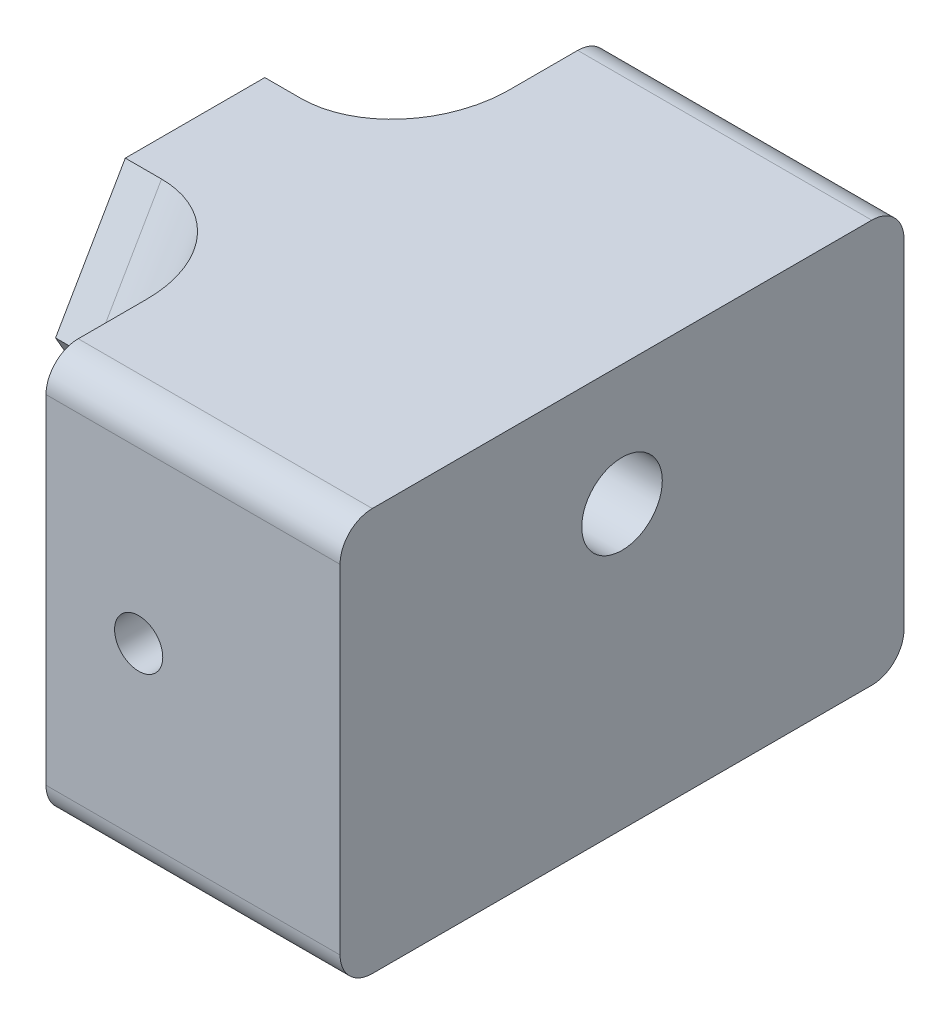
from build123d import *

# Parameters (mm, degrees)
BOSS_EXTRUDE1_DEPTH      = 25.4
BOSS_EXTRUDE1_DEPTH_BACK = 8.255
SKETCH1_W                = 44.45
SKETCH1_H                = 31.75
CUT_EXTRUDE1_DEPTH       = 7.9375
SKETCH3_R                = 3.175
CUT_EXTRUDE2_DEPTH       = 65.160143586
SKETCH4_R                = 1.89865
CUT_EXTRUDE4_DEPTH       = 4.7625
FILLET1_R                = 2.54
CUT_EXTRUDE5_DEPTH       = 10.4775
FILLET2_R                = 7.62


with BuildPart() as part:
    # Sketch1 → Boss-Extrude1 (new, two sides: drawn at the far end of the back side and taken through both)
    with BuildSketch(Plane(origin=(0, 0, 0), x_dir=(0, 0, -1), z_dir=(1, 0, 0)).offset(-BOSS_EXTRUDE1_DEPTH_BACK)):
        with Locations((22.225, -15.875)):
            Rectangle(SKETCH1_W, SKETCH1_H)
    extrude(amount=BOSS_EXTRUDE1_DEPTH + BOSS_EXTRUDE1_DEPTH_BACK)

    # Sketch2 → Cut-Extrude1 (cut)
    with BuildSketch(Plane.ZY.offset(8.255)):
        Polygon((-18.558825791, -15.875), (-14.892651581, -9.525), (-18.558825791, -3.175), (-25.891174209, -3.175), (-29.557348419, -9.525), (-25.891174209, -15.875), align=None)
    extrude(amount=-CUT_EXTRUDE1_DEPTH, mode=Mode.SUBTRACT)

    # Sketch3 → Cut-Extrude2 (cut, through all)
    with BuildSketch(Plane(origin=(25.4, 0, 0), x_dir=(0, 0, -1), z_dir=(1, 0, 0))):
        with Locations((22.225, -9.525)):
            Circle(SKETCH3_R)
    extrude(amount=-CUT_EXTRUDE2_DEPTH, mode=Mode.SUBTRACT)

    # Sketch4 → Cut-Extrude4 (cut)
    with BuildSketch(Plane.XY):
        with Locations((9.525, -15.875)):
            Circle(SKETCH4_R)
    cut_extrude4 = extrude(amount=-CUT_EXTRUDE4_DEPTH, mode=Mode.SUBTRACT)

    # Mirror3: Cut-Extrude4 across plane
    add(cut_extrude4.mirror(Plane.XY.offset(-22.225)), mode=Mode.SUBTRACT)

    # Fillet1
    fillet1_edges = [part.edges().sort_by_distance(p)[0] for p in [
        (8.5725, 0, 0),
        (8.5725, 0, -44.45),
        (8.5725, -31.75, -44.45),
        (8.5725, -31.75, 0),
    ]]
    fillet(fillet1_edges, radius=FILLET1_R)

    # Sketch5 → Cut-Extrude5 (cut)
    with BuildSketch(Plane.ZY.offset(8.255)):
        with BuildLine():
            Line((-44.45, -2.54), (-44.45, -29.21))
            ThreePointArc((-44.45, -29.21), (-43.706051224, -31.006051224), (-41.91, -31.75))
            Line((-41.91, -31.75), (-2.54, -31.75))
            ThreePointArc((-2.54, -31.75), (-0.743948776, -31.006051224), (0, -29.21))
            Line((0, -29.21), (0, -2.54))
            ThreePointArc((0, -2.54), (-0.743948776, -0.743948776), (-2.54, 0))
            Line((-2.54, 0), (-16.725738686, 0))
            Line((-16.725738686, 0), (-11.226477372, -9.525))
            Line((-11.226477372, -9.525), (-16.725738686, -19.05))
            Line((-16.725738686, -19.05), (-27.724261314, -19.05))
            Line((-27.724261314, -19.05), (-33.223522628, -9.525))
            Line((-33.223522628, -9.525), (-27.724261314, 0))
            Line((-27.724261314, 0), (-41.91, 0))
            ThreePointArc((-41.91, 0), (-43.706051224, -0.743948776), (-44.45, -2.54))
        make_face()
    extrude(amount=-CUT_EXTRUDE5_DEPTH, mode=Mode.SUBTRACT)

    # Fillet2
    fillet2_edges = [part.edges().sort_by_distance(p)[0] for p in [
        (2.2225, -4.7625, -30.473891971),
        (2.2225, -14.2875, -30.473891971),
        (2.2225, -19.05, -22.225),
        (2.2225, -14.2875, -13.976108029),
        (2.2225, -4.7625, -13.976108029),
    ]]
    fillet(fillet2_edges, radius=FILLET2_R)


solid = part.part
